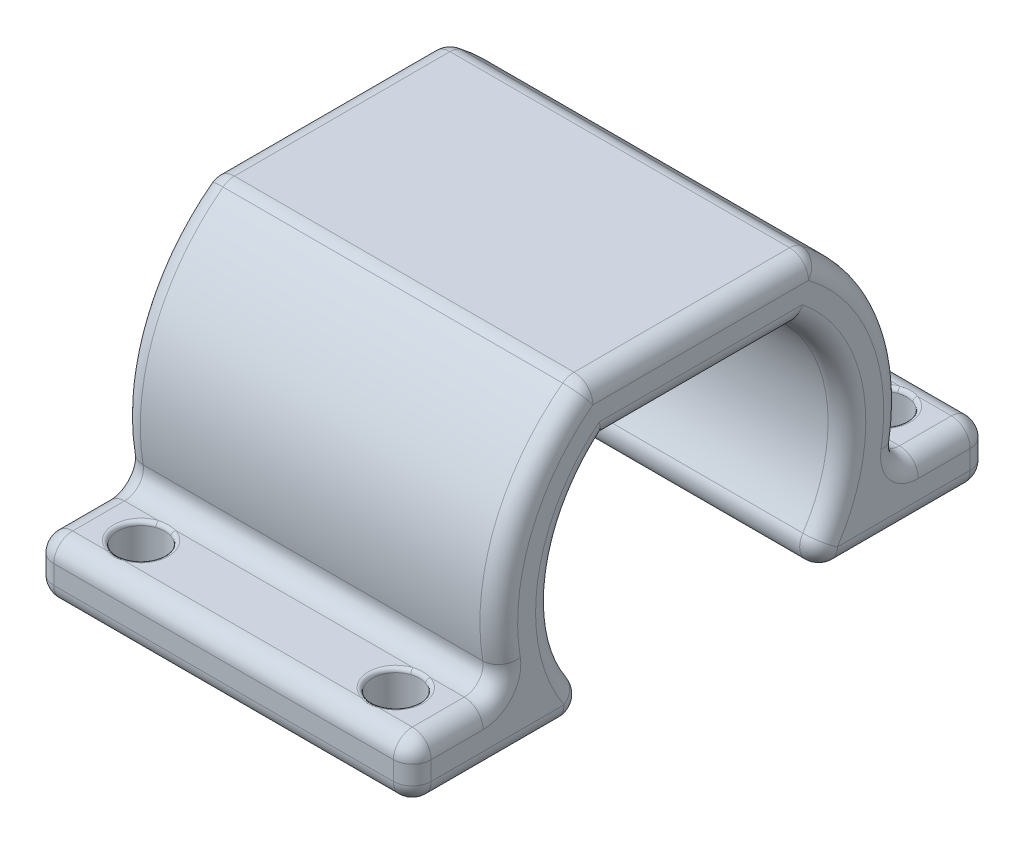
from build123d import *

# Parameters (mm, degrees)
EXTRUDE_1_DEPTH     = 20
FILLET_1_R          = 1
FILLET_2_R          = 1
SKETCH_2_R          = 1.25
CUT_EXTRUDE_1_DEPTH = 28.885306066
FILLET_3_R          = 0.2


with BuildPart() as part:
    # Эскиз1 → Бобышка-Вытянуть1 (new body)
    with BuildSketch(Plane(origin=(0, 0, 0), x_dir=(0, 0, -1), z_dir=(1, 0, 0))):
        with BuildLine():
            Line((15.283660896, -3), (10.283660896, -3))
            ThreePointArc((10.283660896, -3), (10.06880662, 3.675444063), (6.036831932, 9))
            Line((6.036831932, 9), (-6.036831932, 9))
            ThreePointArc((-6.036831932, 9), (-10.06880662, 3.675444063), (-10.283660896, -3))
            Line((-10.283660896, -3), (-15.283660896, -3))
            Line((-15.283660896, -3), (-15.283660896, -6))
            Line((-15.283660896, -6), (-5.075096599, -6))
            ThreePointArc((-5.075096599, -6), (-7.749912378, 0.03759815), (-5.018931811, 6.05))
            Line((-5.018931811, 6.05), (5.018931811, 6.05))
            ThreePointArc((5.018931811, 6.05), (7.749912378, 0.03759815), (5.075096599, -6))
            Line((5.075096599, -6), (15.283660896, -6))
            Line((15.283660896, -6), (15.283660896, -3))
        make_face()
    extrude(amount=EXTRUDE_1_DEPTH)

    # Скругление1
    fillet_1_edges = [part.edges().sort_by_distance(p)[0] for p in [
        (10, -6, -5.075096599),
        (10, -6, 5.075096599),
    ]]
    fillet(fillet_1_edges, radius=FILLET_1_R)

    # Скругление2
    fillet_2_edges = [part.edges().sort_by_distance(p)[0] for p in [
        (0, 9, 0),
        (0, 3.675444063, -10.06880662),
        (20, -4.5, 15.283660896),
        (0, -3, -12.783660896),
        (0, -4.5, -15.283660896),
        (0, 1.061454552, -7.679859163),
        (0, 6.05, 0),
        (0, -6, 11.265178105),
        (0, -4.5, 15.283660896),
        (0, -3, 12.783660896),
        (0, 3.675444063, 10.06880662),
        (20, -6, 11.265178105),
        (10, 9, 6.036831932),
        (10, 9, -6.036831932),
        (10, -3, -10.283660896),
        (10, -3, -15.283660896),
        (10, -6, -15.283660896),
        (10, -6, 15.283660896),
        (10, -3, 15.283660896),
        (10, -3, 10.283660896),
        (20, 6.05, 0),
        (20, 1.061454552, -7.679859163),
        (0, 1.061454552, 7.679859163),
        (20, 1.061454552, 7.679859163),
        (0, -6, -11.265178105),
        (0, -5.473565947, -6.365936951),
        (20, -4.5, -15.283660896),
        (0, -5.473565947, 6.365936951),
        (20, -6, -11.265178105),
        (20, -5.473565947, -6.365936951),
        (20, -5.473565947, 6.365936951),
        (20, -3, -12.783660896),
        (20, 3.675444063, -10.06880662),
        (20, 9, 0),
        (20, 3.675444063, 10.06880662),
        (20, -3, 12.783660896),
    ]]
    fillet(fillet_2_edges, radius=FILLET_2_R)

    # Эскиз2 → Вырез-Вытянуть1 (cut, through all)
    with BuildSketch(Plane(origin=(0, -3, 0), x_dir=(1, 0, 0), z_dir=(0, 1, 0))):
        with Locations(Location((3.25, 12.908028273, 0), (0, 0, 270))):
            Circle(SKETCH_2_R)
        with Locations(Location((16.75, 12.908028273, 0), (0, 0, 270))):
            Circle(SKETCH_2_R)
        with Locations(Location((3.25, -12.908028273, 0), (0, 0, 90))):
            Circle(SKETCH_2_R)
        with Locations(Location((16.75, -12.908028273, 0), (0, 0, 90))):
            Circle(SKETCH_2_R)
    extrude(amount=-CUT_EXTRUDE_1_DEPTH, mode=Mode.SUBTRACT)

    # Скругление3
    fillet_3_edges = [part.edges().sort_by_distance(p)[0] for p in [
        (3.25, -3, 14.158028273),
        (16.75, -3, -14.158028273),
        (16.75, -3, 14.158028273),
        (3.25, -3, -14.158028273),
    ]]
    fillet(fillet_3_edges, radius=FILLET_3_R)


solid = part.part
